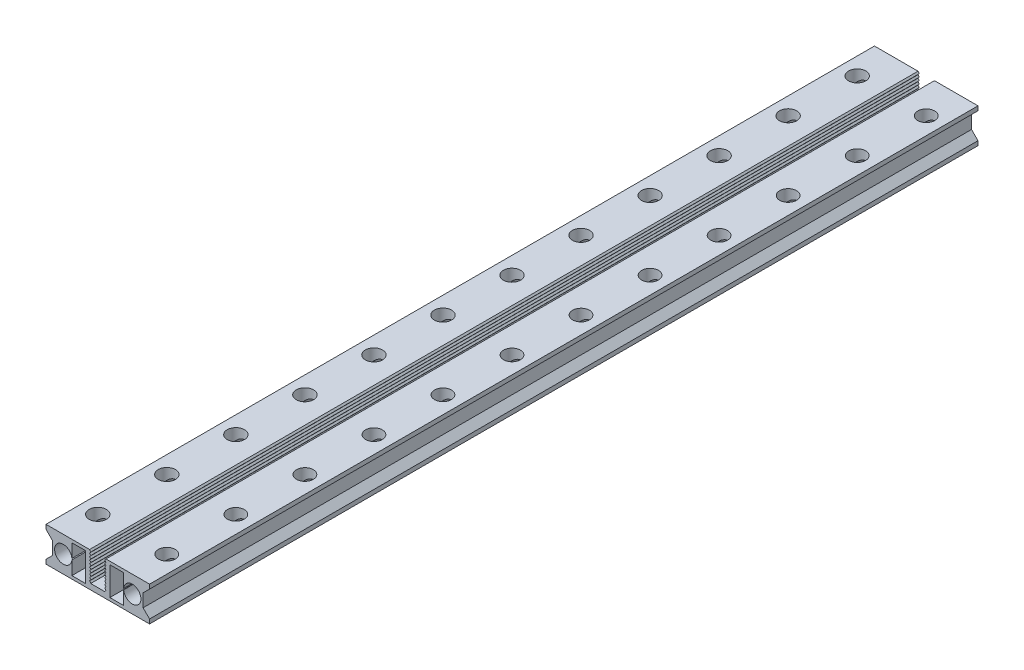
from build123d import *

# Parameters (mm, degrees)
EXTRUDE_2_DEPTH        = 192
EXTRUDE_3_DEPTH        = 192
PATTERN_LINEAR_1_COUNT = 10
PATTERN_LINEAR_1_PITCH = 0.7
MIRROR_1_COPY_1_DEPTH  = 192
MIRROR_1_COPY_2_DEPTH  = 192
MIRROR_1_COPY_3_DEPTH  = 192
MIRROR_1_COPY_4_DEPTH  = 192
MIRROR_1_COPY_5_DEPTH  = 192
MIRROR_1_COPY_6_DEPTH  = 192
MIRROR_1_COPY_7_DEPTH  = 192
MIRROR_1_COPY_8_DEPTH  = 192
MIRROR_1_COPY_9_DEPTH  = 192
SKETCH_4_R             = 2
SKETCH_4_R_2           = 1.95
CUT_EXTRUDE_1_DEPTH    = 193.540904745
PATTERN_LINEAR_2_COUNT = 12
PATTERN_LINEAR_2_PITCH = 16


with BuildPart() as part:
    # 草图1 → 凸台-拉伸2 (new body)
    with BuildSketch(Plane.XY):
        Polygon((-1.9, 8), (-12, 8), (-12, 7), (-10.5, 5.5), (-10.5, 2.5), (-12, 1), (-12, 0), (12, 0), (12, 1), (10.5, 2.5), (10.5, 5.5), (12, 7), (12, 8), (1.9, 8), (1.9, 1.3), (-1.9, 1.3), align=None)
        with BuildLine():
            Line((-6.005, 4.14133294), (-6.005, 7.3))
            Line((-6.005, 7.3), (-2.8, 7.3))
            Line((-2.8, 7.3), (-2.8, 0.7))
            Line((-2.8, 0.7), (-6.005, 0.7))
            Line((-6.005, 0.7), (-6.005, 3.85866706))
            ThreePointArc((-6.005, 3.85866706), (-10, 4), (-6.005, 4.14133294))
        make_face(mode=Mode.SUBTRACT)
        with BuildLine():
            Line((2.8, 0.7), (2.8, 7.3))
            Line((2.8, 7.3), (6.005, 7.3))
            Line((6.005, 7.3), (6.005, 4.14133294))
            ThreePointArc((6.005, 4.14133294), (10, 4), (6.005, 3.85866706))
            Line((6.005, 3.85866706), (6.005, 0.7))
            Line((6.005, 0.7), (2.8, 0.7))
        make_face(mode=Mode.SUBTRACT)
    extrude(amount=EXTRUDE_2_DEPTH)

    # 草图3 → 凸台-拉伸3 (add)
    with BuildSketch(Plane.XY.offset(192)):
        Polygon((-1.9, 8), (-1.6, 7.65), (-1.9, 7.3), align=None)
    extrude_3 = extrude(amount=-EXTRUDE_3_DEPTH)

    # 阵列(线性)1: 凸台-拉伸3 ×10
    with Locations(*[(0, -i * PATTERN_LINEAR_1_PITCH, 0) for i in range(1, PATTERN_LINEAR_1_COUNT)]):
        add(extrude_3)

    # 镜向1: 凸台-拉伸3 across plane
    add(extrude_3.mirror(Plane(origin=(0, 0, 0), x_dir=(0, 0, 1), z_dir=(1, 0, 0))))

    # 镜向1 copy 1 sketch → 镜向1 copy 1 (add)
    with BuildSketch(Plane(origin=(0, -0.7, 192), x_dir=(-1, 0, 0), z_dir=(0, 0, 1))):
        Polygon((-1.9, -8), (-1.6, -7.65), (-1.9, -7.3), align=None)
    extrude(amount=-MIRROR_1_COPY_1_DEPTH)

    # 镜向1 copy 2 sketch → 镜向1 copy 2 (add)
    with BuildSketch(Plane(origin=(0, -1.4, 192), x_dir=(-1, 0, 0), z_dir=(0, 0, 1))):
        Polygon((-1.9, -8), (-1.6, -7.65), (-1.9, -7.3), align=None)
    extrude(amount=-MIRROR_1_COPY_2_DEPTH)

    # 镜向1 copy 3 sketch → 镜向1 copy 3 (add)
    with BuildSketch(Plane(origin=(0, -2.1, 192), x_dir=(-1, 0, 0), z_dir=(0, 0, 1))):
        Polygon((-1.9, -8), (-1.6, -7.65), (-1.9, -7.3), align=None)
    extrude(amount=-MIRROR_1_COPY_3_DEPTH)

    # 镜向1 copy 4 sketch → 镜向1 copy 4 (add)
    with BuildSketch(Plane(origin=(0, -2.8, 192), x_dir=(-1, 0, 0), z_dir=(0, 0, 1))):
        Polygon((-1.9, -8), (-1.6, -7.65), (-1.9, -7.3), align=None)
    extrude(amount=-MIRROR_1_COPY_4_DEPTH)

    # 镜向1 copy 5 sketch → 镜向1 copy 5 (add)
    with BuildSketch(Plane(origin=(0, -3.5, 192), x_dir=(-1, 0, 0), z_dir=(0, 0, 1))):
        Polygon((-1.9, -8), (-1.6, -7.65), (-1.9, -7.3), align=None)
    extrude(amount=-MIRROR_1_COPY_5_DEPTH)

    # 镜向1 copy 6 sketch → 镜向1 copy 6 (add)
    with BuildSketch(Plane(origin=(0, -4.2, 192), x_dir=(-1, 0, 0), z_dir=(0, 0, 1))):
        Polygon((-1.9, -8), (-1.6, -7.65), (-1.9, -7.3), align=None)
    extrude(amount=-MIRROR_1_COPY_6_DEPTH)

    # 镜向1 copy 7 sketch → 镜向1 copy 7 (add)
    with BuildSketch(Plane(origin=(0, -4.9, 192), x_dir=(-1, 0, 0), z_dir=(0, 0, 1))):
        Polygon((-1.9, -8), (-1.6, -7.65), (-1.9, -7.3), align=None)
    extrude(amount=-MIRROR_1_COPY_7_DEPTH)

    # 镜向1 copy 8 sketch → 镜向1 copy 8 (add)
    with BuildSketch(Plane(origin=(0, -5.6, 192), x_dir=(-1, 0, 0), z_dir=(0, 0, 1))):
        Polygon((-1.9, -8), (-1.6, -7.65), (-1.9, -7.3), align=None)
    extrude(amount=-MIRROR_1_COPY_8_DEPTH)

    # 镜向1 copy 9 sketch → 镜向1 copy 9 (add)
    with BuildSketch(Plane(origin=(0, -6.3, 192), x_dir=(-1, 0, 0), z_dir=(0, 0, 1))):
        Polygon((-1.9, -8), (-1.6, -7.65), (-1.9, -7.3), align=None)
    extrude(amount=-MIRROR_1_COPY_9_DEPTH)

    # 草图4 → 切除-拉伸1 (cut, through all)
    with BuildSketch(Plane(origin=(0, 8, 0), x_dir=(1, 0, 0), z_dir=(0, 1, 0))):
        with Locations(Location((-8, -8, 0), (0, 0, 180))):
            Circle(SKETCH_4_R)
        with Locations(Location((8, -8, 0), (0, 0, 180))):
            Circle(SKETCH_4_R_2)
    cut_extrude_1 = extrude(amount=-CUT_EXTRUDE_1_DEPTH, mode=Mode.SUBTRACT)

    # 阵列(线性)2: 切除-拉伸1 ×12
    with Locations(*[(0, 0, i * PATTERN_LINEAR_2_PITCH) for i in range(1, PATTERN_LINEAR_2_COUNT)]):
        add(cut_extrude_1, mode=Mode.SUBTRACT)


solid = part.part
